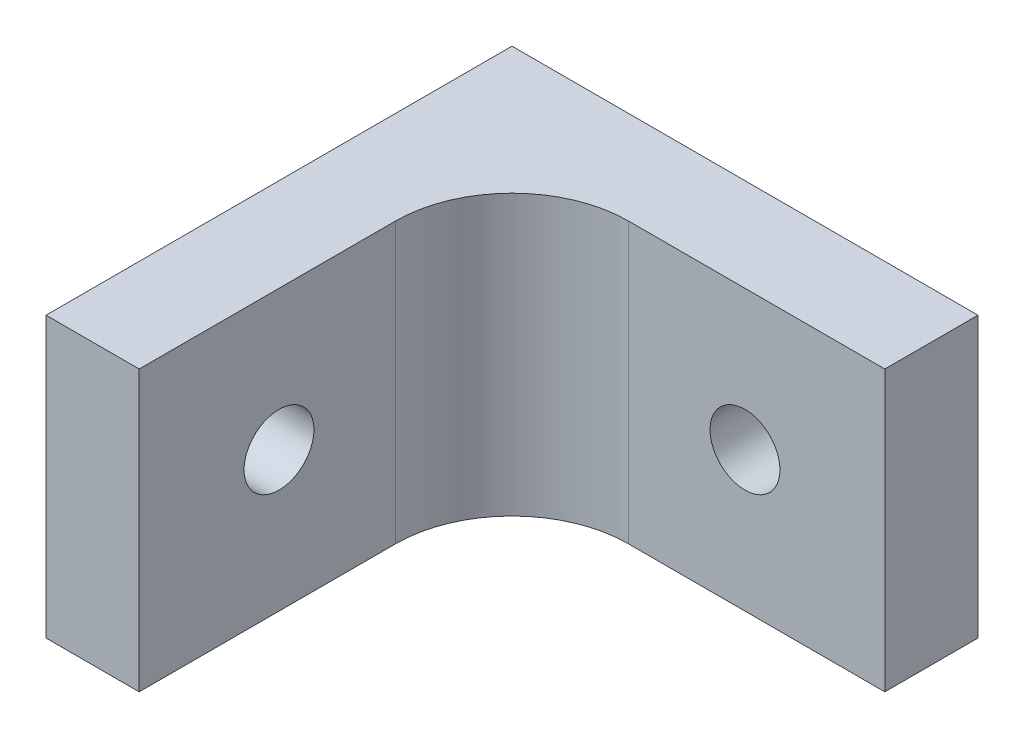
from build123d import *

# Parameters (mm, degrees)
SKETCH1_W           = 10
SKETCH1_H           = 6
SKETCH1_R           = 0.75
BOSS_EXTRUDE1_DEPTH = 2
SKETCH2_W           = 10
SKETCH2_H           = 6
SKETCH2_R           = 0.75
BOSS_EXTRUDE2_DEPTH = 2
FILLET2_R           = 2.5


with BuildPart() as part:
    # Sketch1 → Boss-Extrude1 (new body)
    with BuildSketch(Plane.XY):
        with Locations((-5, -3)):
            Rectangle(SKETCH1_W, SKETCH1_H)
        with Locations((-3, -3)):
            Circle(SKETCH1_R, mode=Mode.SUBTRACT)
    extrude(amount=BOSS_EXTRUDE1_DEPTH)

    # Sketch2 → Boss-Extrude2 (add)
    with BuildSketch(Plane.ZY.offset(10)):
        with Locations((5, -3)):
            Rectangle(SKETCH2_W, SKETCH2_H)
        with Locations((7, -3)):
            Circle(SKETCH2_R, mode=Mode.SUBTRACT)
    extrude(amount=-BOSS_EXTRUDE2_DEPTH)

    # Fillet2
    fillet2_edges = [part.edges().sort_by_distance(p)[0] for p in [
        (-8, -3, 2),
    ]]
    fillet(fillet2_edges, radius=FILLET2_R)


solid = part.part
